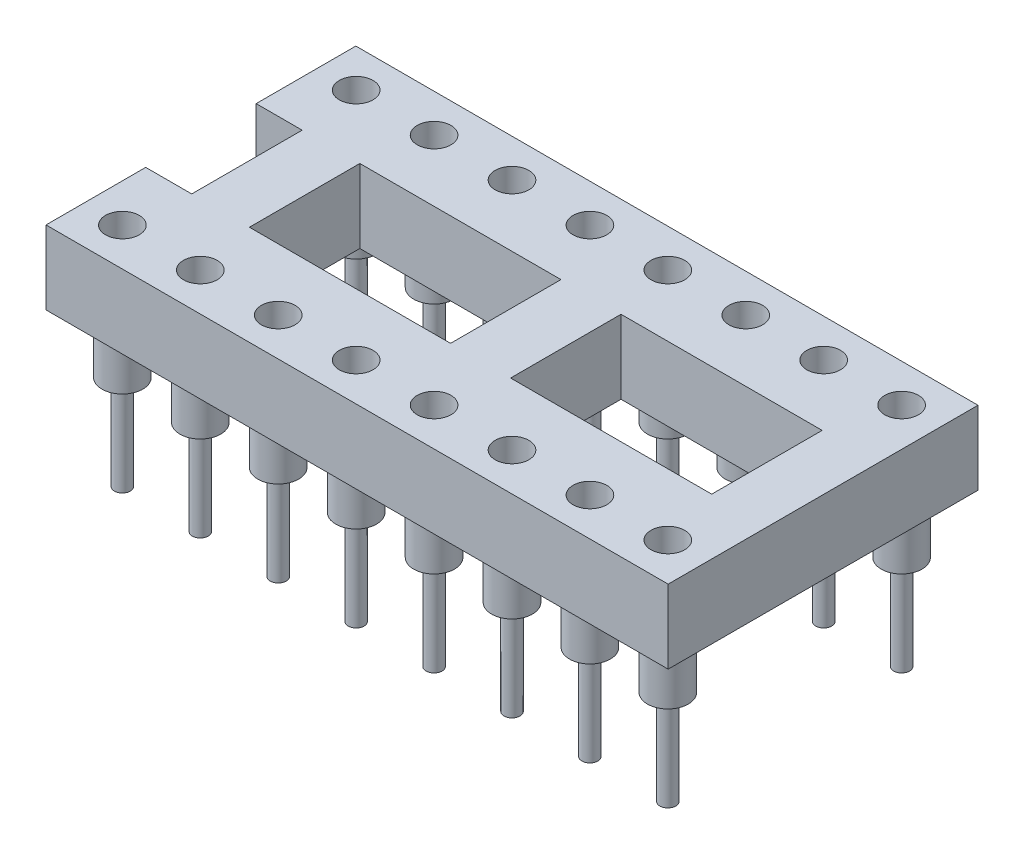
from build123d import *

# Parameters (mm, degrees)
SKETCH1_W            = 6.556101186
SKETCH1_H            = 3.6
BOSS_EXTRUDE1_DEPTH  = 2.4
SKETCH2_R            = 0.55
CUT_EXTRUDE1_DEPTH   = 2
LPATTERN1_COUNT      = 8
LPATTERN1_PITCH      = 2.54
LPATTERN1_COUNT_DIR2 = 2
LPATTERN1_PITCH_DIR2 = 7.62


with BuildPart() as part:
    # Sketch1 → Boss-Extrude1 (new body)
    with BuildSketch(Plane(origin=(0, 0, 0), x_dir=(1, 0, 0), z_dir=(0, 1, 0))):
        Polygon((10.14, 2.883247803), (10.14, -2.179313718), (10.14, -5.05), (-10.14, -5.05), (-10.14, -1.8), (-8.64, -1.8), (-8.64, 1.8), (-10.14, 1.8), (-10.14, 5.05), (10.14, 5.05), align=None)
        with Locations((5.031949407, 0)):
            Rectangle(SKETCH1_W, SKETCH1_H, mode=Mode.SUBTRACT)
        with Locations((-3.481949407, 0)):
            Rectangle(SKETCH1_W, SKETCH1_H, mode=Mode.SUBTRACT)
    extrude(amount=BOSS_EXTRUDE1_DEPTH)

    # Sketch2 → Cut-Extrude1 (cut)
    with BuildSketch(Plane(origin=(0, 2.4, 0), x_dir=(1, 0, 0), z_dir=(0, 1, 0))):
        with Locations(Location((-8.89, -3.81, 0), (0, 0, 270))):
            Circle(SKETCH2_R)
    cut_extrude1 = extrude(amount=-CUT_EXTRUDE1_DEPTH, mode=Mode.SUBTRACT)

    # Sketch3 → Revolve1 (revolve)
    with BuildSketch(Plane.XY.offset(3.81), mode=Mode.PRIVATE) as revolve1_sk:
        Polygon((-9.555, 0), (-9.555, -1.9), (-9.15, -1.9), (-9.15, -4.98), (-8.89, -4.98), (-8.89, 0), align=None)
    revolve1 = revolve(revolve1_sk.sketch.rotate(Axis((-8.89, 0, 3.81), (0, 1, 0)), 270), axis=Axis((-8.89, 0, 3.81), (0, 1, 0)))

    # LPattern1: Cut-Extrude1, Revolve1 8 × 2
    with Locations(*[(i * LPATTERN1_PITCH, 0, -j * LPATTERN1_PITCH_DIR2) for i in range(LPATTERN1_COUNT) for j in range(LPATTERN1_COUNT_DIR2) if (i, j) != (0, 0)]):
        add(cut_extrude1, mode=Mode.SUBTRACT)
        add(revolve1)


solid = part.part
